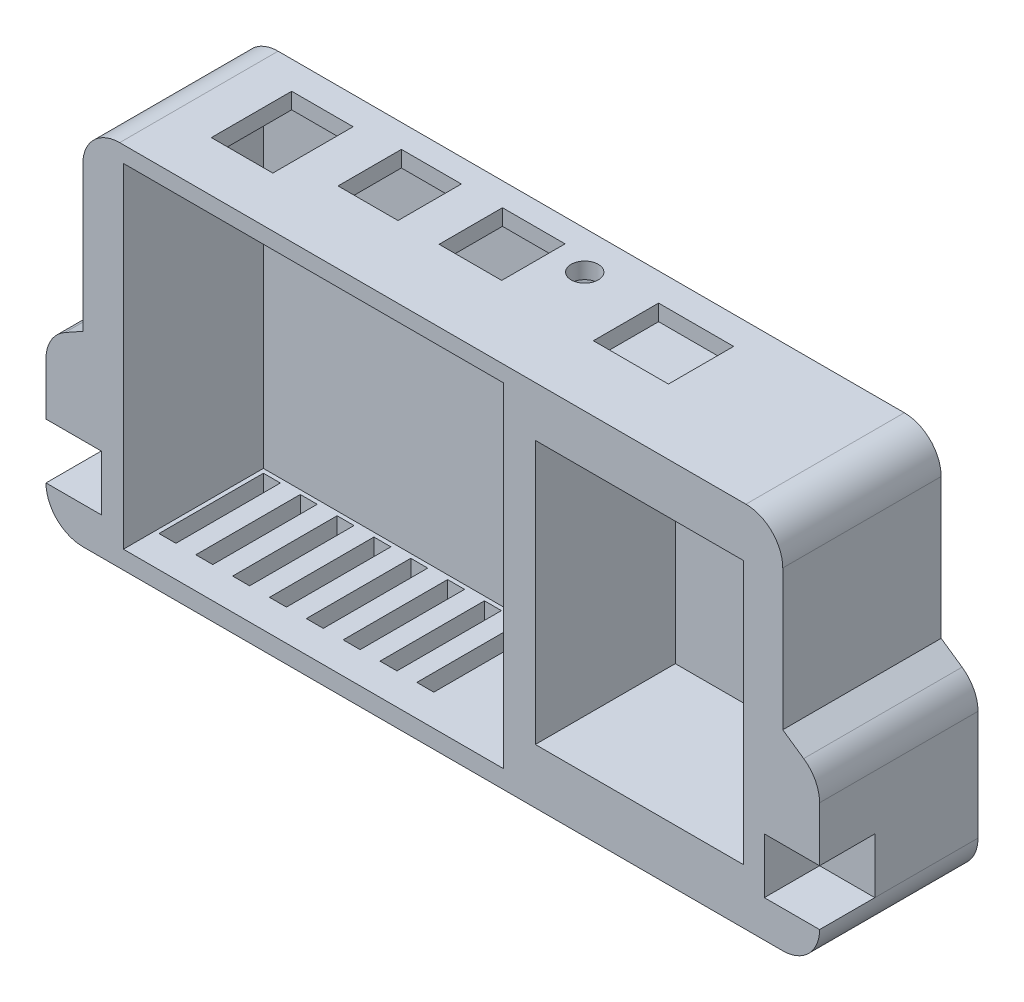
from build123d import *

# Parameters (mm, degrees)
SKETCH_1_W          = 103.2
SKETCH_1_H          = 90.7
SKETCH_1_W_2        = 56.5
SKETCH_1_H_2        = 71.5
EXTRUDE_1_DEPTH     = 43
EXTRUDE_3_DEPTH     = 5
SKETCH_4_R          = 3.682623049
SKETCH_4_W          = 20.371137154
SKETCH_4_H          = 17.709581546
SKETCH_4_W_2        = 16.685906313
SKETCH_4_H_2        = 21.804282482
SKETCH_4_W_3        = 16.276436219
SKETCH_4_H_3        = 17.19774393
SKETCH_4_W_4        = 16.993008883
CUT_EXTRUDE_2_DEPTH = 4.377522815
SKETCH_5_W          = 4.606538552
SKETCH_5_H          = 28.355803979
CUT_EXTRUDE_3_DEPTH = 4.922477185
SKETCH_8_W          = 15
SKETCH_8_H          = 15
CUT_EXTRUDE_5_DEPTH = 15


with BuildPart() as part:
    # 草图1 → 凸台-拉伸1 (new body)
    with BuildSketch(Plane.XY):
        with BuildLine():
            Line((0, 10), (0, 39.186569494))
            ThreePointArc((0, 39.186569494), (1.375838219, 44.248568464), (5.124766715, 47.917669105))
            Line((5.124766715, 47.917669105), (10, 50.639880584))
            Line((10, 50.639880584), (10, 90))
            ThreePointArc((10, 90), (12.928932188, 97.071067812), (20, 100))
            Line((20, 100), (190, 100))
            ThreePointArc((190, 100), (197.071067812, 97.071067812), (200, 90))
            Line((200, 90), (200, 51.963395008))
            Line((200, 51.963395008), (205.683304945, 48.037782396))
            ThreePointArc((205.683304945, 48.037782396), (208.855310538, 44.455580593), (210, 39.809778695))
            Line((210, 39.809778695), (210, 10))
            ThreePointArc((210, 10), (207.071067812, 2.928932188), (200, 0))
            Line((200, 0), (10, 0))
            ThreePointArc((10, 0), (2.928932188, 2.928932188), (0, 10))
        make_face()
        with Locations((72.614593403, 50.272477185)):
            Rectangle(SKETCH_1_W, SKETCH_1_H, mode=Mode.SUBTRACT)
        with Locations((161.079111209, 50.675353005)):
            Rectangle(SKETCH_1_W_2, SKETCH_1_H_2, mode=Mode.SUBTRACT)
    extrude(amount=EXTRUDE_1_DEPTH)

    # 草图3 → 凸台-拉伸3 (add)
    with BuildSketch(Plane.XY):
        with BuildLine():
            Line((0, 10), (0, 39.186569494))
            ThreePointArc((0, 39.186569494), (1.375838219, 44.248568464), (5.124766715, 47.917669105))
            Line((5.124766715, 47.917669105), (10, 50.639880584))
            Line((10, 50.639880584), (10, 90))
            ThreePointArc((10, 90), (12.928932188, 97.071067812), (20, 100))
            Line((20, 100), (180, 100))
            ThreePointArc((180, 100), (187.071067812, 97.071067812), (190, 90))
            Line((190, 90), (190, 51.963395008))
            Line((190, 51.963395008), (195.683304945, 48.037782396))
            ThreePointArc((195.683304945, 48.037782396), (198.855310538, 44.455580593), (200, 39.809778695))
            Line((200, 39.809778695), (200, 10))
            ThreePointArc((200, 10), (197.071067812, 2.928932188), (190, 0))
            Line((190, 0), (10, 0))
            ThreePointArc((10, 0), (2.928932188, 2.928932188), (0, 10))
        make_face()
    extrude(amount=EXTRUDE_3_DEPTH)

    # 草图4 → 切除-拉伸2 (cut)
    with BuildSketch(Plane(origin=(0, 100, 0), x_dir=(1, 0, 0), z_dir=(0, 1, 0))):
        with Locations(Location((113.563696849, -10.32262821, 0), (0, 0, 180))):
            Circle(SKETCH_4_R)
        with Locations((141.053854619, -16.426982565)):
            Rectangle(SKETCH_4_W, SKETCH_4_H)
        with Locations((39.603161201, -18.474333033)):
            Rectangle(SKETCH_4_W_2, SKETCH_4_H_2)
        with Locations((67.958965179, -14.942653476)):
            Rectangle(SKETCH_4_W_3, SKETCH_4_H_3)
        with Locations((95.751747779, -14.942653476)):
            Rectangle(SKETCH_4_W_4, SKETCH_4_H_3)
    extrude(amount=-CUT_EXTRUDE_2_DEPTH, mode=Mode.SUBTRACT)

    # 草图5 → 切除-拉伸3 (cut)
    with BuildSketch(Plane.XZ):
        with Locations((34.452767739, 20.30710257)):
            Rectangle(SKETCH_5_W, SKETCH_5_H)
        with Locations((24.452767739, 20.30710257)):
            Rectangle(SKETCH_5_W, SKETCH_5_H)
        with Locations((44.452767739, 20.30710257)):
            Rectangle(SKETCH_5_W, SKETCH_5_H)
        with Locations((54.452767739, 20.30710257)):
            Rectangle(SKETCH_5_W, SKETCH_5_H)
        with Locations((64.452767739, 20.30710257)):
            Rectangle(SKETCH_5_W, SKETCH_5_H)
        with Locations((74.452767739, 20.30710257)):
            Rectangle(SKETCH_5_W, SKETCH_5_H)
        with Locations((84.452767739, 20.30710257)):
            Rectangle(SKETCH_5_W, SKETCH_5_H)
        with Locations((94.452767739, 20.30710257)):
            Rectangle(SKETCH_5_W, SKETCH_5_H)
    extrude(amount=-CUT_EXTRUDE_3_DEPTH, mode=Mode.SUBTRACT)

    # 草图8 → 切除-拉伸5 (cut)
    with BuildSketch(Plane.ZY):
        with Locations((35.5, 17.5)):
            Rectangle(SKETCH_8_W, SKETCH_8_H)
    cut_extrude_5 = extrude(amount=-CUT_EXTRUDE_5_DEPTH, mode=Mode.SUBTRACT)

    # 镜向1: 切除-拉伸5 across plane
    add(cut_extrude_5.mirror(Plane.ZY.offset(-105)), mode=Mode.SUBTRACT)


solid = part.part
